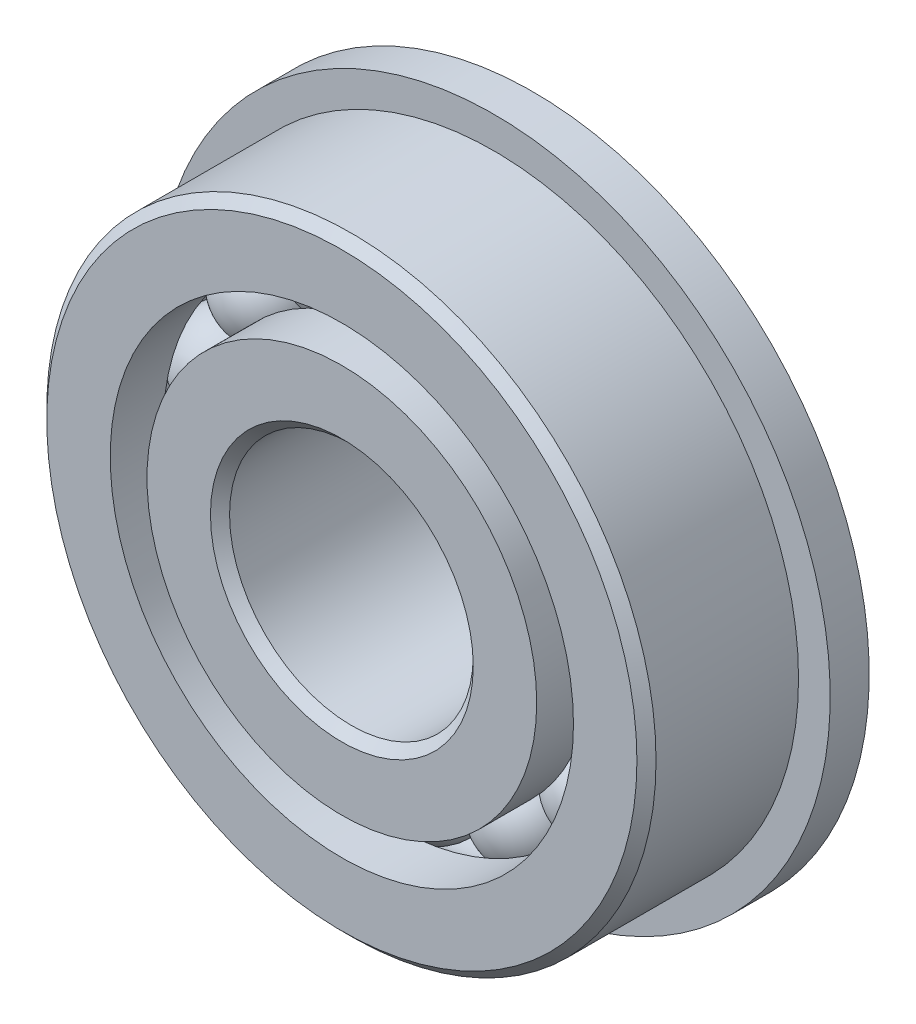
from build123d import *

# Parameters (mm, degrees)
CIRPATTERN1_COUNT = 14
SKETCH6_W         = 1.016
SKETCH6_H         = 2.727778571


with BuildPart() as part:
    # Sketch1 → Revolve1 (revolve)
    with BuildSketch(Plane(origin=(0, 0, 0), x_dir=(0, 0, -1), z_dir=(1, 0, 0)), mode=Mode.PRIVATE) as revolve1_sk:
        with BuildLine():
            Line((2.24028, 7.9375), (-2.24028, 7.9375))
            Line((-2.24028, 7.9375), (-2.4892, 7.68858))
            Line((-2.4892, 7.68858), (-2.4892, 6.035221429))
            Line((-2.4892, 6.035221429), (-1.106311111, 6.035221429))
            ThreePointArc((-1.106311111, 6.035221429), (0, 6.76179465), (1.106311111, 6.035221429))
            Line((1.106311111, 6.035221429), (2.4892, 6.035221429))
            Line((2.4892, 6.035221429), (2.4892, 7.68858))
            Line((2.4892, 7.68858), (2.24028, 7.9375))
        make_face()
    revolve(revolve1_sk.sketch.rotate(Axis((0, 0, 2.4892), (0, 0, -1)), 90), axis=Axis((0, 0, 2.4892), (0, 0, -1)))

    # Sketch6 → Revolve6 (revolve)
    with BuildSketch(Plane(origin=(0, 0, 0), x_dir=(0, 0, -1), z_dir=(1, 0, 0)), mode=Mode.PRIVATE) as revolve6_sk:
        with Locations((1.9812, 7.399110715)):
            Rectangle(SKETCH6_W, SKETCH6_H)
    revolve(revolve6_sk.sketch.rotate(Axis((0, 0, -2.4892), (0, 0, 1)), 270), axis=Axis((0, 0, -2.4892), (0, 0, 1)))


with BuildPart() as body_2:
    # Sketch3 → Revolve3 (revolve)
    with BuildSketch(Plane(origin=(0, 0, 0), x_dir=(0, 0, -1), z_dir=(1, 0, 0)), mode=Mode.PRIVATE) as revolve3_sk:
        with BuildLine():
            Line((-2.4892, 5.077278571), (-1.106311111, 5.077278571))
            ThreePointArc((-1.106311111, 5.077278571), (0, 4.35070535), (1.106311111, 5.077278571))
            Line((1.106311111, 5.077278571), (2.4892, 5.077278571))
            Line((2.4892, 5.077278571), (2.4892, 3.42392))
            Line((2.4892, 3.42392), (2.24028, 3.175))
            Line((2.24028, 3.175), (-2.24028, 3.175))
            Line((-2.24028, 3.175), (-2.4892, 3.42392))
            Line((-2.4892, 3.42392), (-2.4892, 5.077278571))
        make_face()
    revolve(revolve3_sk.sketch.rotate(Axis((0, 0, 2.4892), (0, 0, -1)), 90), axis=Axis((0, 0, 2.4892), (0, 0, -1)))


with BuildPart() as body_3:
    # Sketch4 → Revolve4 (revolve)
    with BuildSketch(Plane(origin=(0, 0, 0), x_dir=(0, 0, -1), z_dir=(1, 0, 0))):
        with BuildLine():
            Line((-1.20554465, 5.55625), (1.20554465, 5.55625))
            ThreePointArc((1.20554465, 5.55625), (0, 6.76179465), (-1.20554465, 5.55625))
        make_face()
    revolve(axis=Axis((0, 5.55625, 1.20554465), (0, 0, -1)))


with BuildPart() as cirpattern1_1:
    # CirPattern1: pattern copy
    add(body_3.part.rotate(Axis((0, 0, 0), (0, 0, 1)), 1 * 360 / CIRPATTERN1_COUNT))


with BuildPart() as cirpattern1_2:
    # CirPattern1: pattern copy
    add(body_3.part.rotate(Axis((0, 0, 0), (0, 0, 1)), 2 * 360 / CIRPATTERN1_COUNT))


with BuildPart() as cirpattern1_3:
    # CirPattern1: pattern copy
    add(body_3.part.rotate(Axis((0, 0, 0), (0, 0, 1)), 3 * 360 / CIRPATTERN1_COUNT))


with BuildPart() as cirpattern1_4:
    # CirPattern1: pattern copy
    add(body_3.part.rotate(Axis((0, 0, 0), (0, 0, 1)), 4 * 360 / CIRPATTERN1_COUNT))


with BuildPart() as cirpattern1_5:
    # CirPattern1: pattern copy
    add(body_3.part.rotate(Axis((0, 0, 0), (0, 0, 1)), 5 * 360 / CIRPATTERN1_COUNT))


with BuildPart() as cirpattern1_6:
    # CirPattern1: pattern copy
    add(body_3.part.rotate(Axis((0, 0, 0), (0, 0, 1)), 6 * 360 / CIRPATTERN1_COUNT))


with BuildPart() as cirpattern1_7:
    # CirPattern1: pattern copy
    add(body_3.part.rotate(Axis((0, 0, 0), (0, 0, 1)), 7 * 360 / CIRPATTERN1_COUNT))


with BuildPart() as cirpattern1_8:
    # CirPattern1: pattern copy
    add(body_3.part.rotate(Axis((0, 0, 0), (0, 0, 1)), 8 * 360 / CIRPATTERN1_COUNT))


with BuildPart() as cirpattern1_9:
    # CirPattern1: pattern copy
    add(body_3.part.rotate(Axis((0, 0, 0), (0, 0, 1)), 9 * 360 / CIRPATTERN1_COUNT))


with BuildPart() as cirpattern1_10:
    # CirPattern1: pattern copy
    add(body_3.part.rotate(Axis((0, 0, 0), (0, 0, 1)), 10 * 360 / CIRPATTERN1_COUNT))


with BuildPart() as cirpattern1_11:
    # CirPattern1: pattern copy
    add(body_3.part.rotate(Axis((0, 0, 0), (0, 0, 1)), 11 * 360 / CIRPATTERN1_COUNT))


with BuildPart() as cirpattern1_12:
    # CirPattern1: pattern copy
    add(body_3.part.rotate(Axis((0, 0, 0), (0, 0, 1)), 12 * 360 / CIRPATTERN1_COUNT))


with BuildPart() as cirpattern1_13:
    # CirPattern1: pattern copy
    add(body_3.part.rotate(Axis((0, 0, 0), (0, 0, 1)), 13 * 360 / CIRPATTERN1_COUNT))


solid = Compound([part.part, body_2.part, body_3.part, cirpattern1_1.part, cirpattern1_2.part, cirpattern1_3.part, cirpattern1_4.part, cirpattern1_5.part, cirpattern1_6.part, cirpattern1_7.part, cirpattern1_8.part, cirpattern1_9.part, cirpattern1_10.part, cirpattern1_11.part, cirpattern1_12.part, cirpattern1_13.part])
